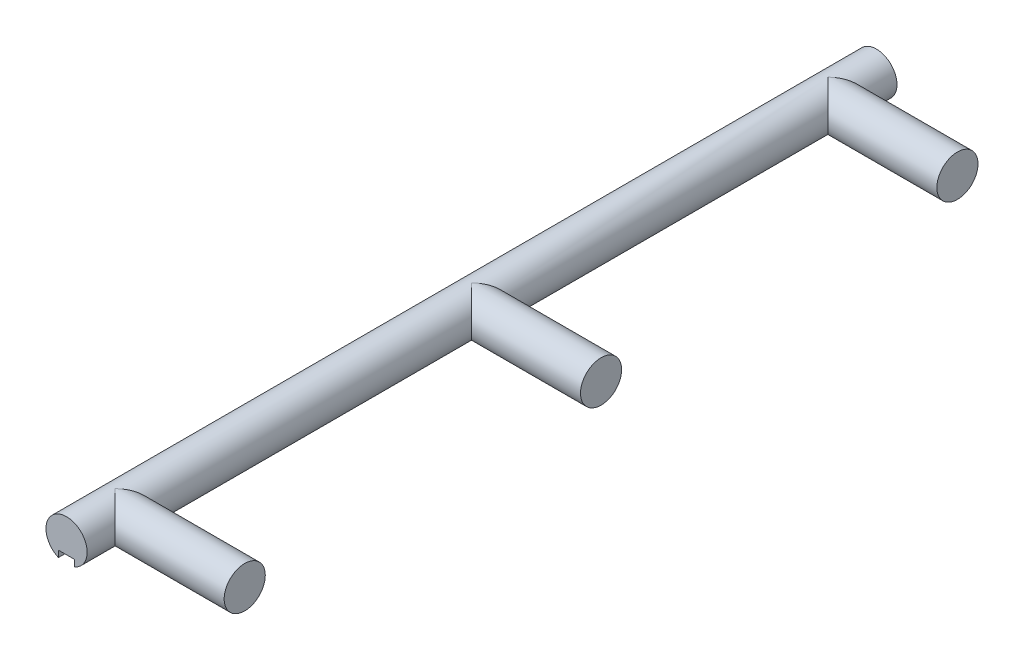
from build123d import *

# Parameters (mm, degrees)
CROQUIS1_R              = 6.35
SALIENTE_EXTRUIR1_DEPTH = 125
CROQUIS2_R              = 6.35
SALIENTE_EXTRUIR2_DEPTH = 40
CROQUIS3_W              = 5
CROQUIS3_H              = 5
CORTAR_EXTRUIR1_DEPTH   = 20


with BuildPart() as part:
    # Croquis1 → Saliente-Extruir1 (new, symmetric)
    with BuildSketch(Plane.XY):
        Circle(CROQUIS1_R)
    extrude(amount=SALIENTE_EXTRUIR1_DEPTH, both=True)

    # Croquis2 → Saliente-Extruir2 (add)
    with BuildSketch(Plane(origin=(0, 0, 0), x_dir=(0, 0, -1), z_dir=(1, 0, 0))):
        Circle(CROQUIS2_R)
        with Locations((110, 0)):
            Circle(CROQUIS2_R)
        with Locations((-110, 0)):
            Circle(CROQUIS2_R)
    extrude(amount=SALIENTE_EXTRUIR2_DEPTH)

    # Croquis3 → Cortar-Extruir1 (cut)
    with BuildSketch(Plane.XY.offset(125)):
        with Locations((0, -6.35)):
            Rectangle(CROQUIS3_W, CROQUIS3_H)
    extrude(amount=-CORTAR_EXTRUIR1_DEPTH, mode=Mode.SUBTRACT)


solid = part.part
